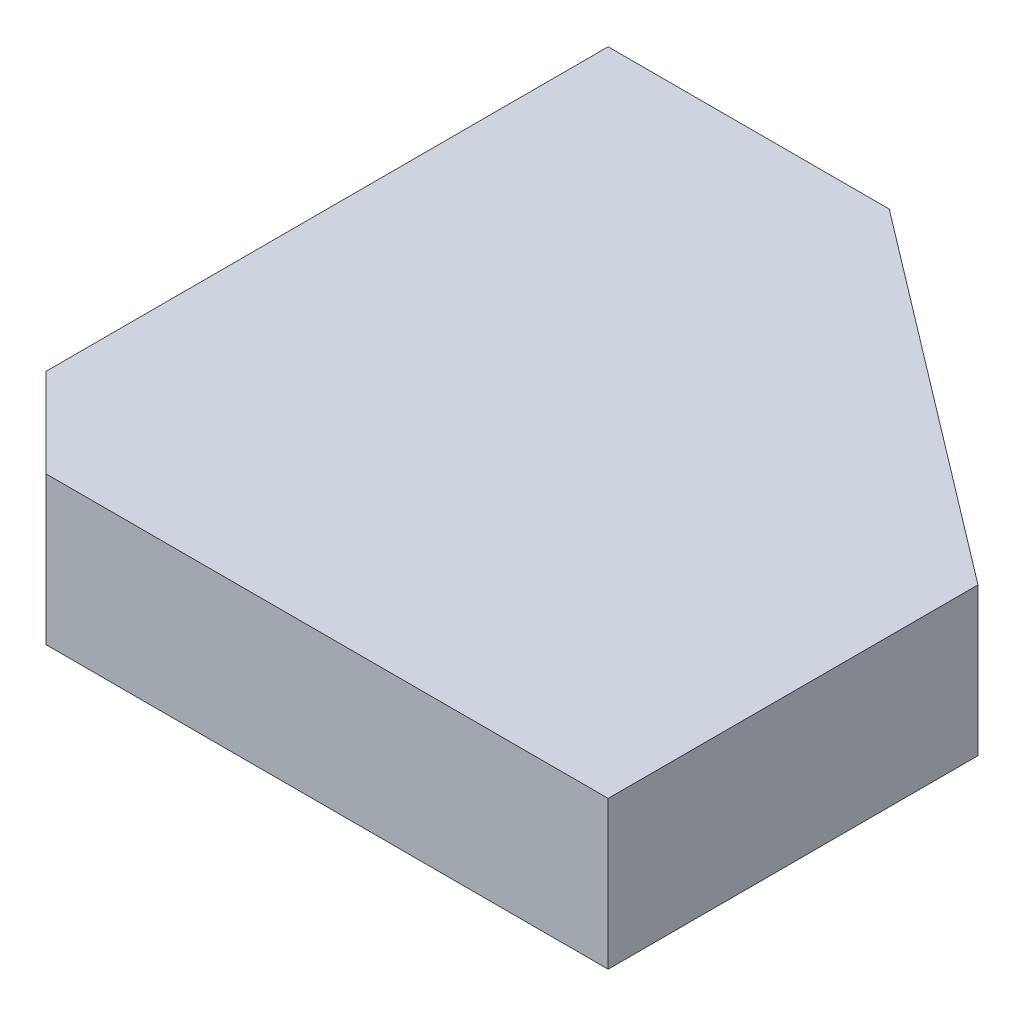
from build123d import *

# Parameters (mm, degrees)
BASE_EXTRUDE_DEPTH = 5
CHAMFER1_SIZE      = 6


with BuildPart() as part:
    # Sketch1 → Base-Extrude (new, symmetric)
    with BuildSketch(Plane(origin=(0, 0, 0), x_dir=(1, 0, 0), z_dir=(0, 1, 0))):
        Polygon((0, 0), (44, 0), (44, 25), (19, 44), (0, 44), align=None)
    extrude(amount=BASE_EXTRUDE_DEPTH, both=True)

    # Chamfer1
    chamfer1_edges = [part.edges().sort_by_distance(p)[0] for p in [
        (0, 0, 0),
    ]]
    chamfer(chamfer1_edges, length=CHAMFER1_SIZE)


solid = part.part
